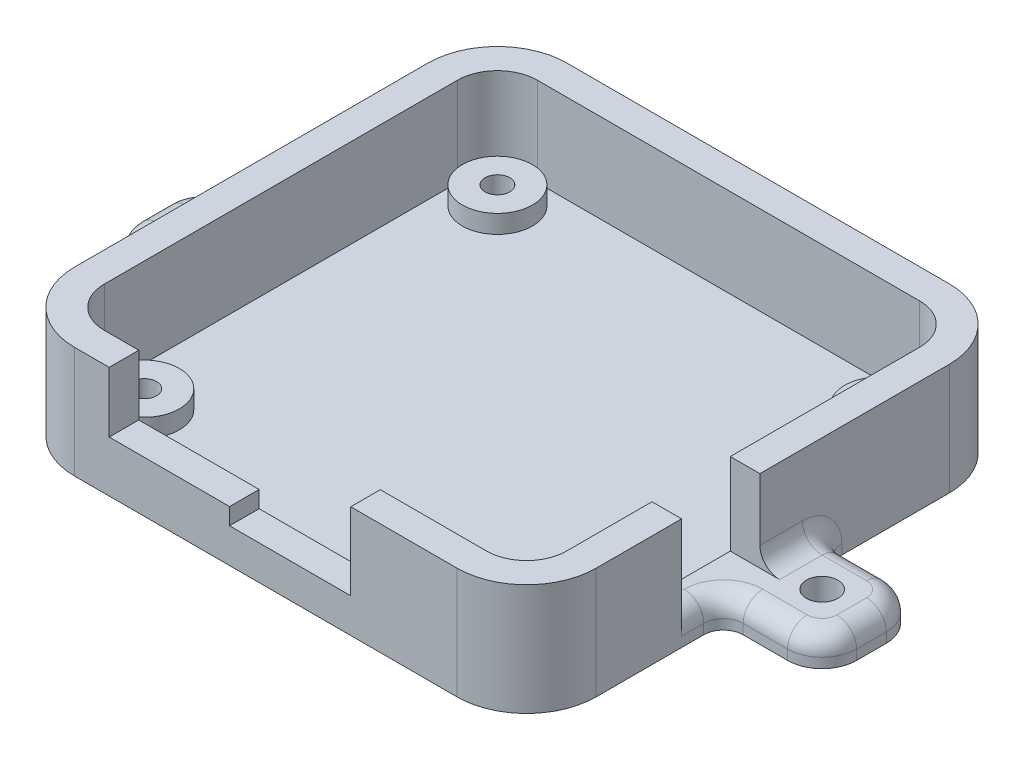
from build123d import *

# Parameters (mm, degrees)
SKETCH1_R           = 3.55
SKETCH1_R_2         = 1.25
BOSS_EXTRUDE1_DEPTH = 2.3
BOSS_EXTRUDE2_START = 2.3
SKETCH1_3_R         = 3.55
SKETCH1_3_R_2       = 1.25
BOSS_EXTRUDE2_DEPTH = 1.85
BOSS_EXTRUDE3_START = 2.3
BOSS_EXTRUDE3_DEPTH = 9
CUT_EXTRUDE3_REACH  = 73.238
SKETCH2_W           = 7.938
SKETCH2_H           = 8.3
CUT_EXTRUDE4_REACH  = 73.092
SKETCH3_W           = 13.048
SKETCH3_H           = 6.12
CUT_EXTRUDE5_REACH  = 73.092
SKETCH4_W           = 12.28
SKETCH4_H           = 7.81
SKETCH5_R           = 1.6
BOSS_EXTRUDE4_DEPTH = 3
FILLET1_R           = 2


with BuildPart() as part:
    # Sketch1 → Boss-Extrude1 (new body)
    # profile 1 of 7: a face of its own
    with BuildSketch(Plane(origin=(0, 0, 0), x_dir=(1, 0, 0), z_dir=(0, 1, 0))):
        with BuildLine():
            ThreePointArc((-3.5, -3.556), (-1.433345448, 1.433345448), (3.556, 3.5))
            Line((3.556, 3.5), (42.304, 3.5))
            ThreePointArc((42.304, 3.5), (47.293345448, 1.433345448), (49.36, -3.556))
            Line((49.36, -3.556), (49.36, -39.344))
            ThreePointArc((49.36, -39.344), (47.293345448, -44.333345448), (42.304, -46.4))
            Line((42.304, -46.4), (3.556, -46.4))
            ThreePointArc((3.556, -46.4), (-1.433345448, -44.333345448), (-3.5, -39.344))
            Line((-3.5, -39.344), (-3.5, -3.556))
        make_face()
        with BuildLine():
            Line((-0.5, -3.556), (-0.5, -39.344))
            ThreePointArc((-0.5, -39.344), (0.687974896, -42.212025104), (3.556, -43.4))
            Line((3.556, -43.4), (42.304, -43.4))
            ThreePointArc((42.304, -43.4), (45.172025104, -42.212025104), (46.36, -39.344))
            Line((46.36, -39.344), (46.36, -3.556))
            ThreePointArc((46.36, -3.556), (45.172025104, -0.687974896), (42.304, 0.5))
            Line((42.304, 0.5), (3.556, 0.5))
            ThreePointArc((3.556, 0.5), (0.687974896, -0.687974896), (-0.5, -3.556))
        make_face(mode=Mode.SUBTRACT)
    # profile 2 of 7: a face of its own
    with BuildSketch(Plane(origin=(0, 0, 0), x_dir=(1, 0, 0), z_dir=(0, 1, 0))):
        with BuildLine():
            ThreePointArc((-0.5, -3.556), (0.687974896, -0.687974896), (3.556, 0.5))
            Line((3.556, 0.5), (42.304, 0.5))
            ThreePointArc((42.304, 0.5), (45.172025104, -0.687974896), (46.36, -3.556))
            Line((46.36, -3.556), (46.36, -39.344))
            ThreePointArc((46.36, -39.344), (45.172025104, -42.212025104), (42.304, -43.4))
            Line((42.304, -43.4), (3.556, -43.4))
            ThreePointArc((3.556, -43.4), (0.687974896, -42.212025104), (-0.5, -39.344))
            Line((-0.5, -39.344), (-0.5, -3.556))
        make_face()
        with BuildLine():
            Line((0, -3.556), (0, -39.344))
            ThreePointArc((0, -39.344), (1.041528286, -41.858471714), (3.556, -42.9))
            Line((3.556, -42.9), (42.304, -42.9))
            ThreePointArc((42.304, -42.9), (44.818471714, -41.858471714), (45.86, -39.344))
            Line((45.86, -39.344), (45.86, -3.556))
            ThreePointArc((45.86, -3.556), (44.818471714, -1.041528286), (42.304, 0))
            Line((42.304, 0), (3.556, 0))
            ThreePointArc((3.556, 0), (1.041528286, -1.041528286), (0, -3.556))
        make_face(mode=Mode.SUBTRACT)
    # profile 3 of 7: a face of its own
    with BuildSketch(Plane(origin=(0, 0, 0), x_dir=(1, 0, 0), z_dir=(0, 1, 0))):
        with BuildLine():
            ThreePointArc((0, -3.556), (1.041528286, -1.041528286), (3.556, 0))
            Line((3.556, 0), (42.304, 0))
            ThreePointArc((42.304, 0), (44.818471714, -1.041528286), (45.86, -3.556))
            Line((45.86, -3.556), (45.86, -39.344))
            ThreePointArc((45.86, -39.344), (44.818471714, -41.858471714), (42.304, -42.9))
            Line((42.304, -42.9), (3.556, -42.9))
            ThreePointArc((3.556, -42.9), (1.041528286, -41.858471714), (0, -39.344))
            Line((0, -39.344), (0, -3.556))
        make_face()
        with Locations((3.556, -39.344)):
            Circle(SKETCH1_R, mode=Mode.SUBTRACT)
        with Locations((42.304, -39.344)):
            Circle(SKETCH1_R, mode=Mode.SUBTRACT)
        with Locations((42.304, -3.556)):
            Circle(SKETCH1_R, mode=Mode.SUBTRACT)
        with Locations((3.556, -3.556)):
            Circle(SKETCH1_R, mode=Mode.SUBTRACT)
    # profile 4 of 7: a face of its own
    with BuildSketch(Plane(origin=(0, 0, 0), x_dir=(1, 0, 0), z_dir=(0, 1, 0))):
        with Locations((42.304, -39.344)):
            Circle(SKETCH1_R)
        with Locations(Location((42.304, -39.344, 0), (0, 0, 270))):
            Circle(SKETCH1_R_2, mode=Mode.SUBTRACT)
    # profile 5 of 7: a face of its own
    with BuildSketch(Plane(origin=(0, 0, 0), x_dir=(1, 0, 0), z_dir=(0, 1, 0))):
        with Locations((3.556, -39.344)):
            Circle(SKETCH1_R)
        with Locations(Location((3.556, -39.344, 0), (0, 0, 270))):
            Circle(SKETCH1_R_2, mode=Mode.SUBTRACT)
    # profile 6 of 7: a face of its own
    with BuildSketch(Plane(origin=(0, 0, 0), x_dir=(1, 0, 0), z_dir=(0, 1, 0))):
        with Locations((3.556, -3.556)):
            Circle(SKETCH1_R)
        with Locations(Location((3.556, -3.556, 0), (0, 0, 270))):
            Circle(SKETCH1_R_2, mode=Mode.SUBTRACT)
    # profile 7 of 7: a face of its own
    with BuildSketch(Plane(origin=(0, 0, 0), x_dir=(1, 0, 0), z_dir=(0, 1, 0))):
        with Locations((42.304, -3.556)):
            Circle(SKETCH1_R)
        with Locations(Location((42.304, -3.556, 0), (0, 0, 270))):
            Circle(SKETCH1_R_2, mode=Mode.SUBTRACT)
    extrude(amount=BOSS_EXTRUDE1_DEPTH)

    # Sketch1<3> → Boss-Extrude2 (add)
    # profile 1 of 4: a face of its own
    with BuildSketch(Plane(origin=(0, 0, 0), x_dir=(1, 0, 0), z_dir=(0, 1, 0)).offset(BOSS_EXTRUDE2_START)):
        with Locations(Location((3.556, -3.556, 0), (0, 0, 270))):
            Circle(SKETCH1_3_R)
        with Locations(Location((3.556, -3.556, 0), (0, 0, 270))):
            Circle(SKETCH1_3_R_2, mode=Mode.SUBTRACT)
    # profile 2 of 4: a face of its own
    with BuildSketch(Plane(origin=(0, 0, 0), x_dir=(1, 0, 0), z_dir=(0, 1, 0)).offset(BOSS_EXTRUDE2_START)):
        with Locations(Location((42.304, -3.556, 0), (0, 0, 270))):
            Circle(SKETCH1_3_R)
        with Locations(Location((42.304, -3.556, 0), (0, 0, 270))):
            Circle(SKETCH1_3_R_2, mode=Mode.SUBTRACT)
    # profile 3 of 4: a face of its own
    with BuildSketch(Plane(origin=(0, 0, 0), x_dir=(1, 0, 0), z_dir=(0, 1, 0)).offset(BOSS_EXTRUDE2_START)):
        with Locations(Location((42.304, -39.344, 0), (0, 0, 270))):
            Circle(SKETCH1_3_R)
        with Locations(Location((42.304, -39.344, 0), (0, 0, 270))):
            Circle(SKETCH1_3_R_2, mode=Mode.SUBTRACT)
    # profile 4 of 4: a face of its own
    with BuildSketch(Plane(origin=(0, 0, 0), x_dir=(1, 0, 0), z_dir=(0, 1, 0)).offset(BOSS_EXTRUDE2_START)):
        with Locations(Location((3.556, -39.344, 0), (0, 0, 270))):
            Circle(SKETCH1_3_R)
        with Locations(Location((3.556, -39.344, 0), (0, 0, 270))):
            Circle(SKETCH1_3_R_2, mode=Mode.SUBTRACT)
    extrude(amount=BOSS_EXTRUDE2_DEPTH)

    # Sketch1<4> → Boss-Extrude3 (add)
    with BuildSketch(Plane(origin=(0, 0, 0), x_dir=(1, 0, 0), z_dir=(0, 1, 0)).offset(BOSS_EXTRUDE3_START)):
        with BuildLine():
            ThreePointArc((-3.5, -3.556), (-1.433345448, 1.433345448), (3.556, 3.5))
            Line((3.556, 3.5), (42.304, 3.5))
            ThreePointArc((42.304, 3.5), (47.293345448, 1.433345448), (49.36, -3.556))
            Line((49.36, -3.556), (49.36, -39.344))
            ThreePointArc((49.36, -39.344), (47.293345448, -44.333345448), (42.304, -46.4))
            Line((42.304, -46.4), (3.556, -46.4))
            ThreePointArc((3.556, -46.4), (-1.433345448, -44.333345448), (-3.5, -39.344))
            Line((-3.5, -39.344), (-3.5, -3.556))
        make_face()
        with BuildLine():
            Line((-0.5, -3.556), (-0.5, -39.344))
            ThreePointArc((-0.5, -39.344), (0.687974896, -42.212025104), (3.556, -43.4))
            Line((3.556, -43.4), (42.304, -43.4))
            ThreePointArc((42.304, -43.4), (45.172025104, -42.212025104), (46.36, -39.344))
            Line((46.36, -39.344), (46.36, -3.556))
            ThreePointArc((46.36, -3.556), (45.172025104, -0.687974896), (42.304, 0.5))
            Line((42.304, 0.5), (3.556, 0.5))
            ThreePointArc((3.556, 0.5), (0.687974896, -0.687974896), (-0.5, -3.556))
        make_face(mode=Mode.SUBTRACT)
    extrude(amount=BOSS_EXTRUDE3_DEPTH)

    # Sketch2 → Cut-Extrude3 (cut, up to next)
    with BuildSketch(Plane(origin=(49.36, 0, 0), x_dir=(0, 0, -1), z_dir=(1, 0, 0)), mode=Mode.PRIVATE) as cut_extrude3_sk1:
        with Locations((-26.725, 7.15)):
            Rectangle(SKETCH2_W, SKETCH2_H)
    cut_extrude3_tool1 = extrude(cut_extrude3_sk1.sketch, amount=-CUT_EXTRUDE3_REACH, mode=Mode.PRIVATE) & part.part
    add(cut_extrude3_tool1.solids().sort_by_distance((49.36, 7.15, 26.725))[0], mode=Mode.SUBTRACT)

    # Sketch3 → Cut-Extrude4 (cut, up to next)
    with BuildSketch(Plane.XY.offset(46.4), mode=Mode.PRIVATE) as cut_extrude4_sk1:
        with Locations((13.58, 8.24)):
            Rectangle(SKETCH3_W, SKETCH3_H)
    cut_extrude4_tool1 = extrude(cut_extrude4_sk1.sketch, amount=-CUT_EXTRUDE4_REACH, mode=Mode.PRIVATE) & part.part
    add(cut_extrude4_tool1.solids().sort_by_distance((13.58, 8.24, 46.4))[0], mode=Mode.SUBTRACT)

    # Sketch4 → Cut-Extrude5 (cut, up to next)
    with BuildSketch(Plane.XY.offset(46.4), mode=Mode.PRIVATE) as cut_extrude5_sk1:
        with Locations((25.394, 7.395)):
            Rectangle(SKETCH4_W, SKETCH4_H)
    cut_extrude5_tool1 = extrude(cut_extrude5_sk1.sketch, amount=-CUT_EXTRUDE5_REACH, mode=Mode.PRIVATE) & part.part
    add(cut_extrude5_tool1.solids().sort_by_distance((25.394, 7.395, 46.4))[0], mode=Mode.SUBTRACT)

    # Sketch5 → Boss-Extrude4 (add)
    # profile 1 of 2: a face of its own
    with BuildSketch(Plane.XZ):
        with BuildLine():
            Line((-3.5, 16.45), (-10, 16.45))
            ThreePointArc((-10, 16.45), (-12.474873734, 17.475126266), (-13.5, 19.95))
            Line((-13.5, 19.95), (-13.5, 22.95))
            ThreePointArc((-13.5, 22.95), (-12.474873734, 25.424873734), (-10, 26.45))
            Line((-10, 26.45), (-3.5, 26.45))
            Line((-3.5, 26.45), (-3.5, 16.45))
        make_face()
        with Locations(Location((-8.5, 21.45, 0), (0, 0, 270))):
            Circle(SKETCH5_R, mode=Mode.SUBTRACT)
    # profile 2 of 2: a face of its own
    with BuildSketch(Plane.XZ):
        with BuildLine():
            Line((49.36, 16.45), (55.86, 16.45))
            ThreePointArc((55.86, 16.45), (58.334873734, 17.475126266), (59.36, 19.95))
            Line((59.36, 19.95), (59.36, 22.95))
            ThreePointArc((59.36, 22.95), (58.334873734, 25.424873734), (55.86, 26.45))
            Line((55.86, 26.45), (49.36, 26.45))
            Line((49.36, 26.45), (49.36, 16.45))
        make_face()
        with Locations(Location((54.36, 21.45, 0), (0, 0, 270))):
            Circle(SKETCH5_R, mode=Mode.SUBTRACT)
    extrude(amount=-BOSS_EXTRUDE4_DEPTH)

    # Fillet1
    fillet1_edges = [part.edges().sort_by_distance(p)[0] for p in [
        (49.36, 3, 28.572),
        (-3.5, 3, 21.45),
        (-3.5, 1.5, 26.45),
        (-6.75, 3, 16.45),
        (-3.5, 1.5, 16.45),
        (-12.474873734, 3, 17.475126266),
        (-13.5, 3, 21.45),
        (-12.474873734, 3, 25.424873734),
        (-6.75, 3, 26.45),
        (49.36, 3, 19.603),
        (49.36, 1.5, 16.45),
        (52.61, 3, 26.45),
        (49.36, 1.5, 26.45),
        (58.334873734, 3, 25.424873734),
        (59.36, 3, 21.45),
        (58.334873734, 3, 17.475126266),
        (52.61, 3, 16.45),
    ]]
    fillet(fillet1_edges, radius=FILLET1_R)


solid = part.part
